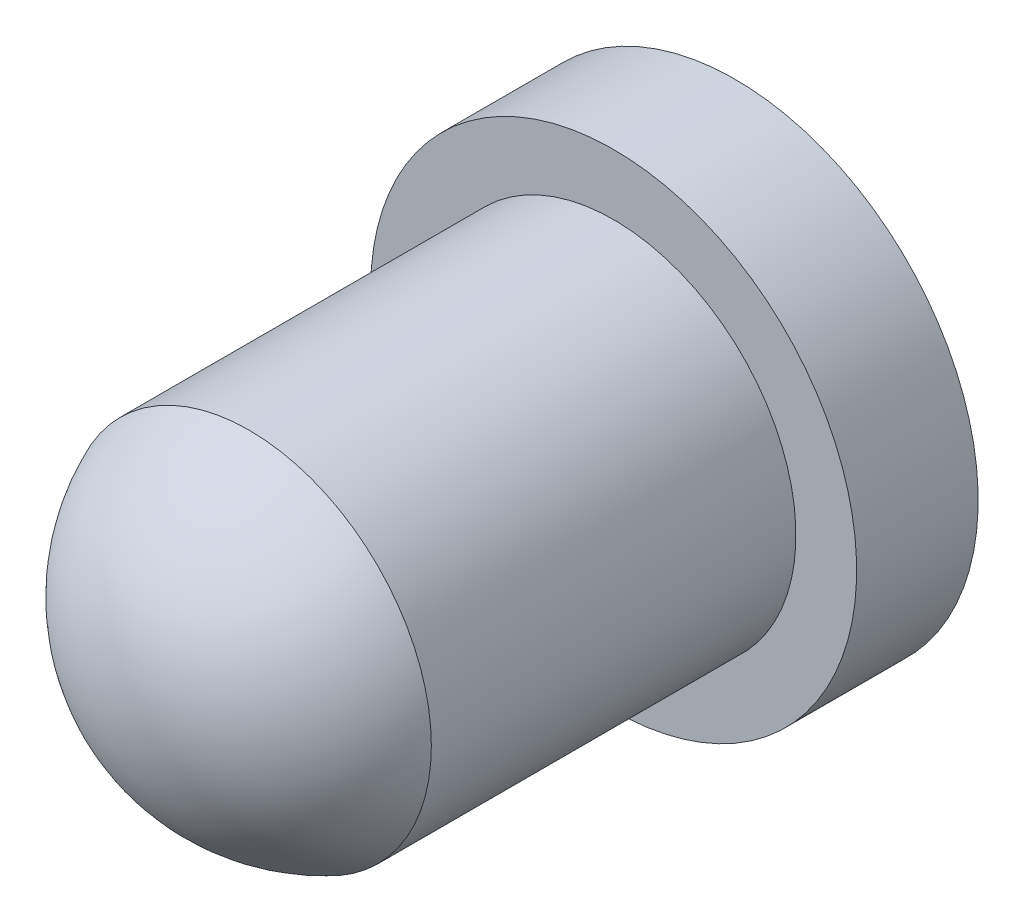
from build123d import *

# Parameters (mm, degrees)
SKETCH_1_R         = 1.5
EXTRUDE_1_DEPTH    = 3
SKETCH_2_R         = 2
EXTRUDE_2_DEPTH    = 1
DOME_1_FACE_RADIUS = 1.5
DOME_1_HEIGHT      = 1


with BuildPart() as part:
    # 草图1 → 拉伸1 (new body)
    with BuildSketch(Plane.XY):
        Circle(SKETCH_1_R)
    extrude(amount=EXTRUDE_1_DEPTH)

    # 草图2 → 拉伸2 (add)
    with BuildSketch(Plane(origin=(0, 0, 0), x_dir=(-1, 0, 0), z_dir=(0, 0, -1))):
        Circle(SKETCH_2_R)
    extrude(amount=EXTRUDE_2_DEPTH)

    # 圆顶1: a dome of height H over a round flat face of radius A is a cap of a sphere of radius (A * A + H * H) / (2 * H)
    dome_1_r = (DOME_1_FACE_RADIUS * DOME_1_FACE_RADIUS + DOME_1_HEIGHT * DOME_1_HEIGHT) / (2 * DOME_1_HEIGHT)
    dome_1_base = Plane((0, 0, 3), z_dir=(0, 0, 1))
    with Locations(dome_1_base.offset(DOME_1_HEIGHT - dome_1_r)):
        dome_1_ball = Sphere(dome_1_r, mode=Mode.PRIVATE)
    add(split(dome_1_ball, bisect_by=dome_1_base, keep=Keep.TOP, mode=Mode.PRIVATE))


solid = part.part
